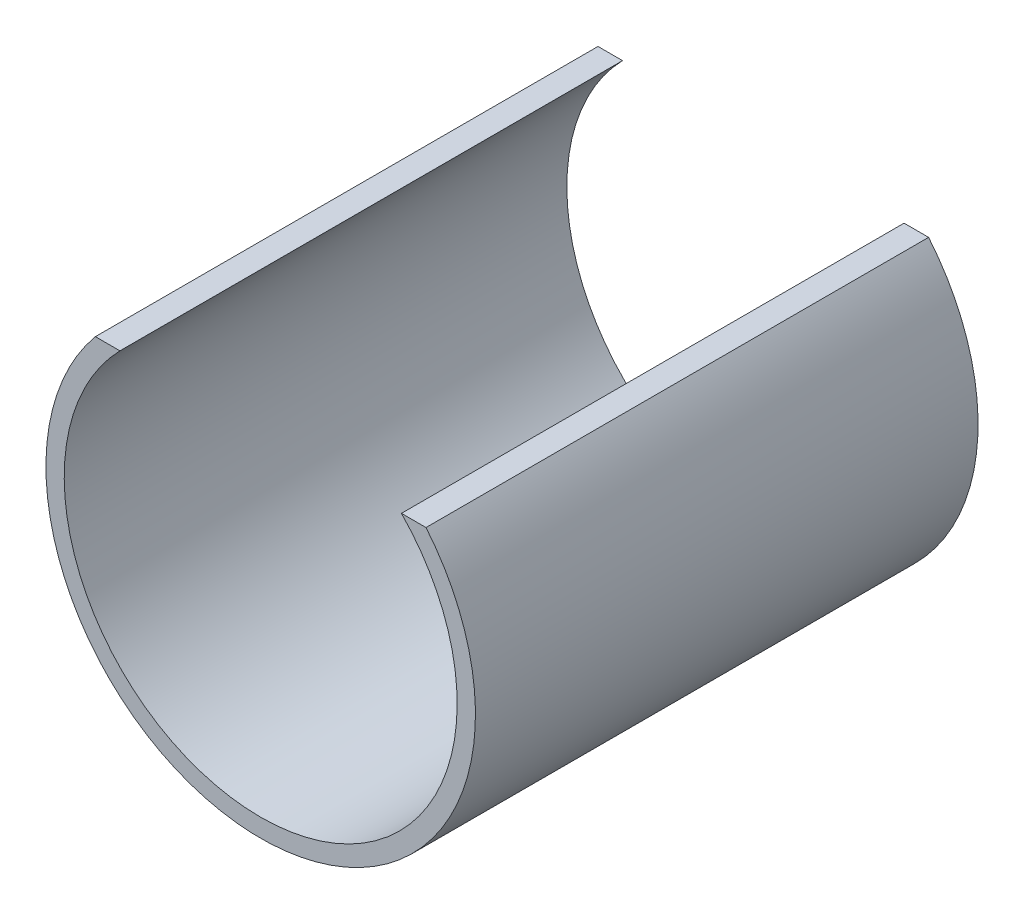
from build123d import *

# Parameters (mm, degrees)
BOSS_EXTRUDE1_DEPTH = 5.5


with BuildPart() as part:
    # Sketch2 → Boss-Extrude1 (new body)
    with BuildSketch(Plane.XY):
        with BuildLine():
            Line((-1.54029218, 1.5), (-1.809005252, 1.5))
            ThreePointArc((-1.809005252, 1.5), (0, -2.35), (1.809005252, 1.5))
            Line((1.809005252, 1.5), (1.54029218, 1.5))
            ThreePointArc((1.54029218, 1.5), (0, -2.15), (-1.54029218, 1.5))
        make_face()
    extrude(amount=-BOSS_EXTRUDE1_DEPTH)


solid = part.part
